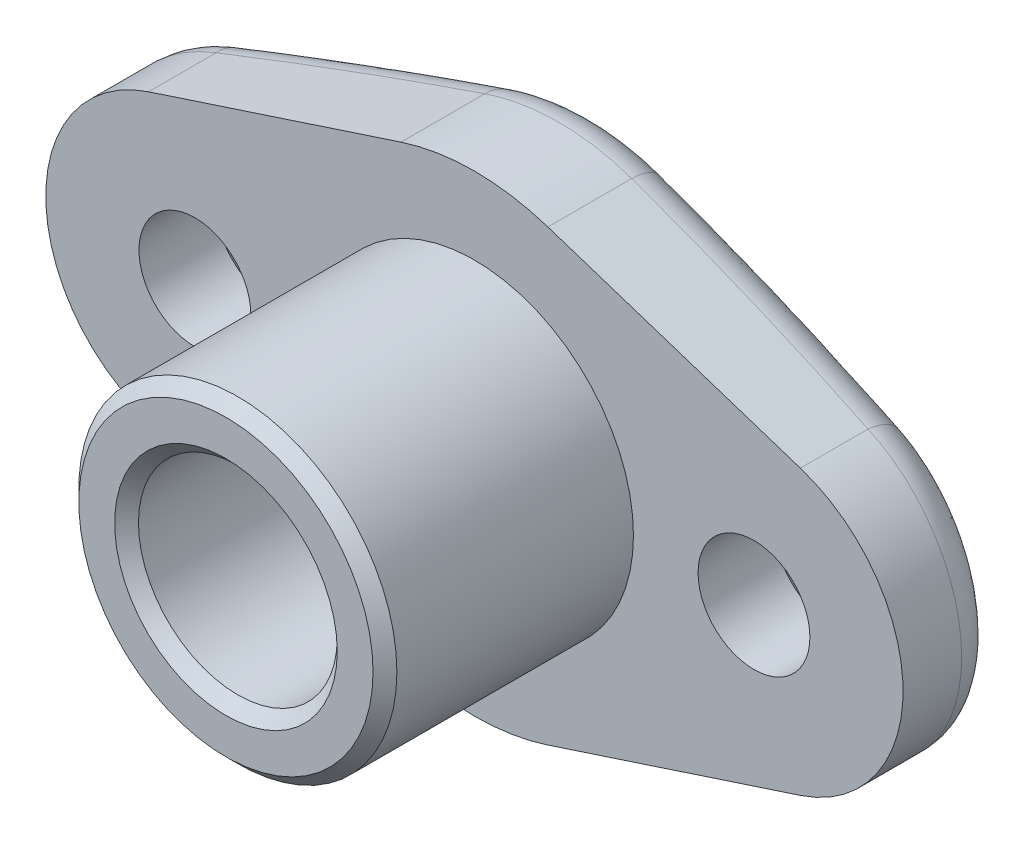
from build123d import *

# Parameters (mm, degrees)
SKETCH3_R          = 1.7859375
EXTRUDE1_DEPTH     = 3.96875
SKETCH4_R          = 5.08
SKETCH4_R_2        = 3.175
EXTRUDE2_DEPTH     = 7.9375
CUT_EXTRUDE2_DEPTH = 38.1
CHAMFER1_SIZE      = 0.381
FILLET1_R          = 1.27
SKETCH8_R          = 3.175
CUT_EXTRUDE3_DEPTH = 20.649321038


with BuildPart() as part:
    # Sketch3 → Extrude1 (new body)
    with BuildSketch(Plane.XY):
        with BuildLine():
            Line((2.345972222, 7.166410519), (10.411354167, 4.526154012))
            ThreePointArc((10.411354167, 4.526154012), (13.6921875, 0), (10.411354167, -4.526154012))
            Line((10.411354167, -4.526154012), (2.345972222, -7.166410519))
            ThreePointArc((2.345972222, -7.166410519), (0, -7.540625), (-2.345972222, -7.166410519))
            Line((-2.345972222, -7.166410519), (-10.411354167, -4.526154012))
            ThreePointArc((-10.411354167, -4.526154012), (-13.6921875, 0), (-10.411354167, 4.526154012))
            Line((-10.411354167, 4.526154012), (-2.345972222, 7.166410519))
            ThreePointArc((-2.345972222, 7.166410519), (0, 7.540625), (2.345972222, 7.166410519))
        make_face()
        with Locations((-8.9296875, 0)):
            Circle(SKETCH3_R, mode=Mode.SUBTRACT)
        with Locations((8.9296875, 0)):
            Circle(SKETCH3_R, mode=Mode.SUBTRACT)
    extrude(amount=EXTRUDE1_DEPTH)

    # Sketch4 → Extrude2 (add)
    with BuildSketch(Plane.XY.offset(3.96875)):
        Circle(SKETCH4_R)
        Circle(SKETCH4_R_2, mode=Mode.SUBTRACT)
    extrude(amount=EXTRUDE2_DEPTH)

    # Cut-Extrude1 cone 1 section (through the dimple's axis) → Cut-Extrude1 (revolve, cut)
    with BuildSketch(Plane.YZ.offset(8.9296875)):
        Polygon((0, 0), (3.571875, 0), (0, 2.997158995), align=None)
    revolve(axis=Axis((8.9296875, 0, 0), (0, 0, 1)), mode=Mode.SUBTRACT)

    # Cut-Extrude1 cone 2 section (through the dimple's axis) → Cut-Extrude1 cone 2 (revolve, cut)
    with BuildSketch(Plane.YZ.offset(-8.9296875)):
        Polygon((0, 0), (3.571875, 0), (0, 2.997158995), align=None)
    revolve(axis=Axis((-8.9296875, 0, 0), (0, 0, 1)), mode=Mode.SUBTRACT)

    # Sketch6 → Cut-Extrude2 (cut, symmetric)
    with BuildSketch(Plane(origin=(0, 0, 0), x_dir=(1, 0, 0), z_dir=(0, 1, 0))):
        with BuildLine():
            Line((13.6921875, -0.9921875), (13.6921875, 0.508))
            Line((13.6921875, 0.508), (-13.6921875, 0.508))
            Line((-13.6921875, 0.508), (-13.6921875, -0.9921875))
            ThreePointArc((-13.6921875, -0.9921875), (0, 0), (13.6921875, -0.9921875))
        make_face()
    extrude(amount=CUT_EXTRUDE2_DEPTH, both=True, mode=Mode.SUBTRACT)

    # Chamfer1
    chamfer1_edges = [part.edges().sort_by_distance(p)[0] for p in [
        (-5.08, 0, 11.90625),
        (-3.175, 0, 11.90625),
    ]]
    chamfer(chamfer1_edges, length=CHAMFER1_SIZE)

    # Fillet1
    fillet1_edges = [part.edges().sort_by_distance(p)[0] for p in [
        (0, 7.540625, 0),
        (0, -7.540625, 0),
        (6.383890186, -5.844571175, 0.214800745),
        (13.6921875, 0, 0.9921875),
        (6.383890186, 5.844571175, 0.214800745),
        (-6.383890186, 5.844571175, 0.214800745),
        (-12.782548247, -2.799441072, 0.864149273),
        (-6.383890186, -5.844571175, 0.214800745),
    ]]
    fillet(fillet1_edges, radius=FILLET1_R)

    # Sketch8 → Cut-Extrude3 (cut, through all)
    with BuildSketch(Plane.XY):
        with Locations(Location((0, 0, 0), (0, 0, 180))):
            Circle(SKETCH8_R)
    extrude(amount=CUT_EXTRUDE3_DEPTH, mode=Mode.SUBTRACT)


solid = part.part
